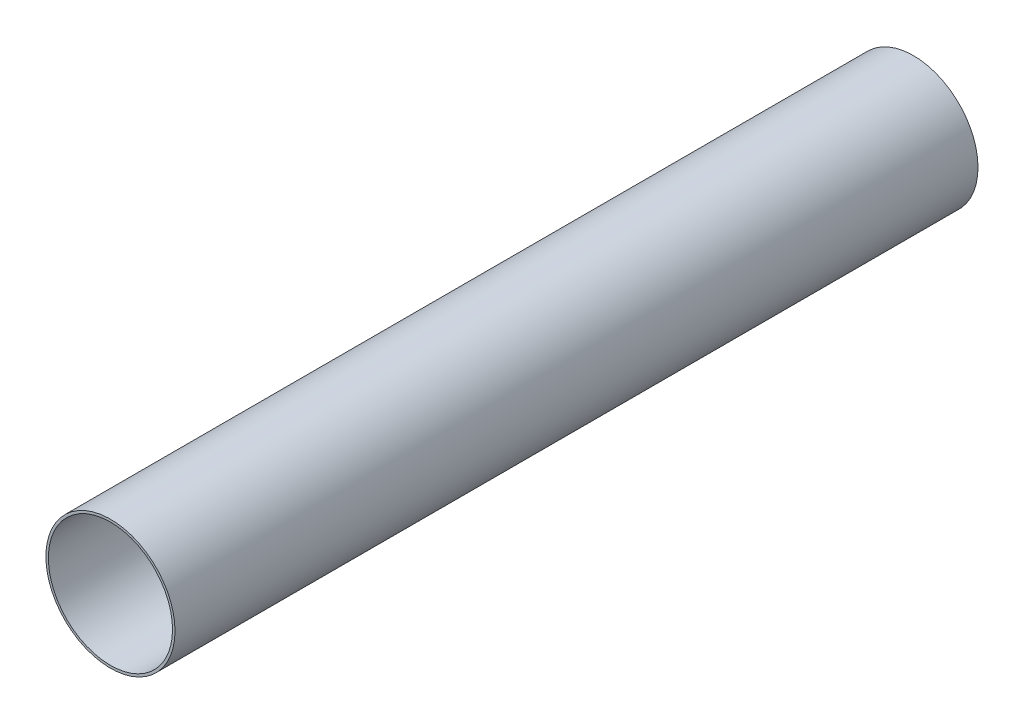
from build123d import *

# Parameters (mm, degrees)
SKETCH1_R           = 78
SKETCH1_R_2         = 75
BOSS_EXTRUDE1_DEPTH = 970


with BuildPart() as part:
    # Sketch1 → Boss-Extrude1 (new body)
    with BuildSketch(Plane.XY):
        Circle(SKETCH1_R)
        Circle(SKETCH1_R_2, mode=Mode.SUBTRACT)
    extrude(amount=-BOSS_EXTRUDE1_DEPTH)


solid = part.part
